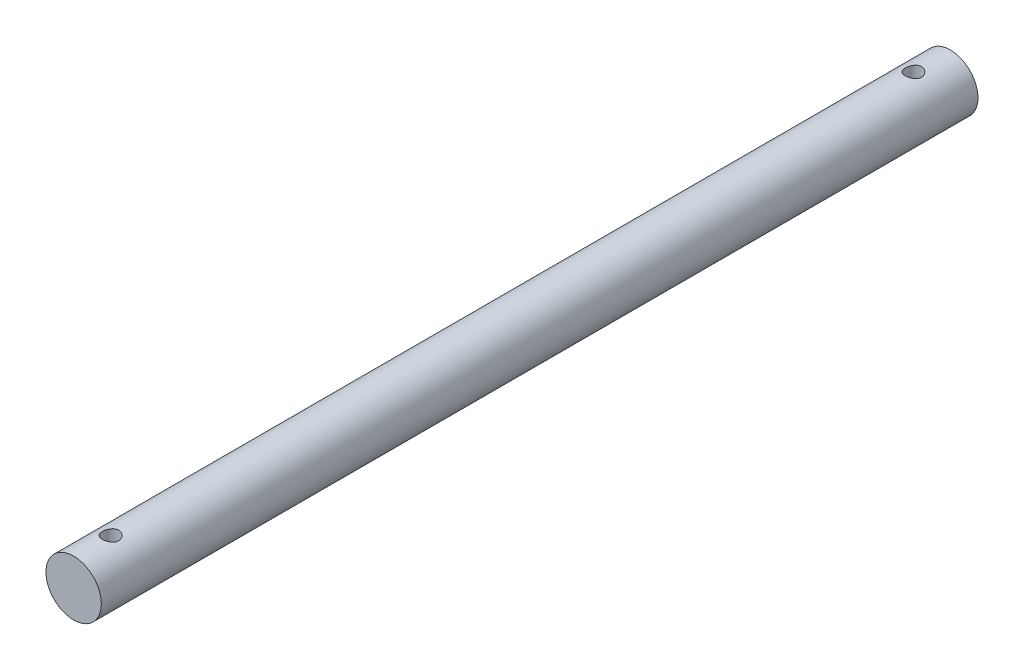
from build123d import *

# Parameters (mm, degrees)
SKETCH1_R               = 6
BOSS_EXTRUDE1_DEPTH     = 190
CUT_EXTRUDE1_DEPTH      = 191.189379304
CUT_EXTRUDE1_DEPTH_BACK = 191.189379304
SKETCH2_R               = 1.75


with BuildPart() as part:
    # Sketch1 → Boss-Extrude1 (new body)
    with BuildSketch(Plane.XY):
        Circle(SKETCH1_R)
    extrude(amount=BOSS_EXTRUDE1_DEPTH)

    # Sketch2 → Cut-Extrude1 (cut, two sides: drawn at the far end of the back side and taken through both)
    with BuildSketch(Plane(origin=(0, 0, 0), x_dir=(1, 0, 0), z_dir=(0, 1, 0)).offset(-CUT_EXTRUDE1_DEPTH_BACK)):
        with Locations(Location((0, -8, 0), (0, 0, 270))):
            Circle(SKETCH2_R)
        with Locations(Location((0, -182, 0), (0, 0, 270))):
            Circle(SKETCH2_R)
    extrude(amount=CUT_EXTRUDE1_DEPTH + CUT_EXTRUDE1_DEPTH_BACK, mode=Mode.SUBTRACT)


solid = part.part
